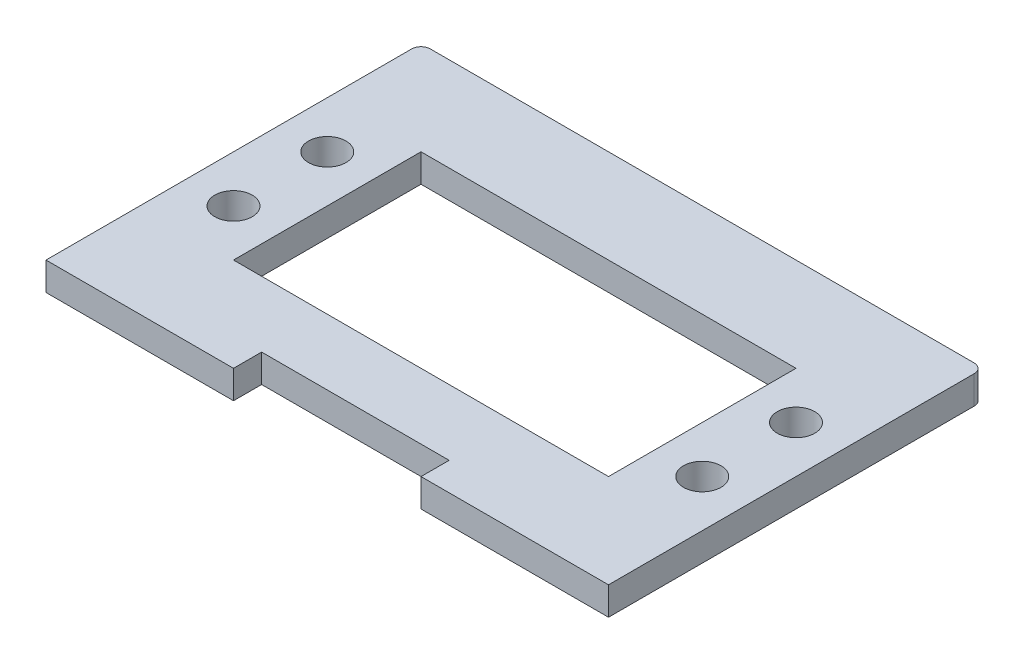
from build123d import *

# Parameters (mm, degrees)
SKETCH1_W           = 60
SKETCH1_H           = 40
BOSS_EXTRUDE1_DEPTH = 3
SKETCH2_W           = 40
SKETCH2_H           = 20
CUT_EXTRUDE1_DEPTH  = 3
SKETCH3_R           = 2
CUT_EXTRUDE2_DEPTH  = 3
FILLET2_R           = 1
SKETCH4_W           = 20
SKETCH4_H           = 6
CUT_EXTRUDE3_DEPTH  = 3


with BuildPart() as part:
    # Sketch1 → Boss-Extrude1 (new body)
    with BuildSketch(Plane(origin=(0, 0, 0), x_dir=(1, 0, 0), z_dir=(0, 1, 0))):
        Rectangle(SKETCH1_W, SKETCH1_H)
    extrude(amount=BOSS_EXTRUDE1_DEPTH)

    # Sketch2 → Cut-Extrude1 (cut)
    with BuildSketch(Plane(origin=(0, 3, 0), x_dir=(1, 0, 0), z_dir=(0, 1, 0))):
        Rectangle(SKETCH2_W, SKETCH2_H)
    extrude(amount=-CUT_EXTRUDE1_DEPTH, mode=Mode.SUBTRACT)

    # Sketch3 → Cut-Extrude2 (cut)
    with BuildSketch(Plane(origin=(0, 3, 0), x_dir=(1, 0, 0), z_dir=(0, 1, 0))):
        with Locations(Location((25, 5, 0), (0, 0, 270))):
            Circle(SKETCH3_R)
        with Locations(Location((25, -5, 0), (0, 0, 90))):
            Circle(SKETCH3_R)
        with Locations(Location((-25, -5, 0), (0, 0, 270))):
            Circle(SKETCH3_R)
        with Locations(Location((-25, 5, 0), (0, 0, 90))):
            Circle(SKETCH3_R)
    extrude(amount=-CUT_EXTRUDE2_DEPTH, mode=Mode.SUBTRACT)

    # Fillet2
    fillet2_edges = [part.edges().sort_by_distance(p)[0] for p in [
        (-30, 1.5, -20),
        (30, 1.5, -20),
    ]]
    fillet(fillet2_edges, radius=FILLET2_R)

    # Sketch4 → Cut-Extrude3 (cut)
    with BuildSketch(Plane(origin=(0, 3, 0), x_dir=(1, 0, 0), z_dir=(0, 1, 0))):
        with Locations((0, -20)):
            Rectangle(SKETCH4_W, SKETCH4_H)
    extrude(amount=-CUT_EXTRUDE3_DEPTH, mode=Mode.SUBTRACT)


solid = part.part
